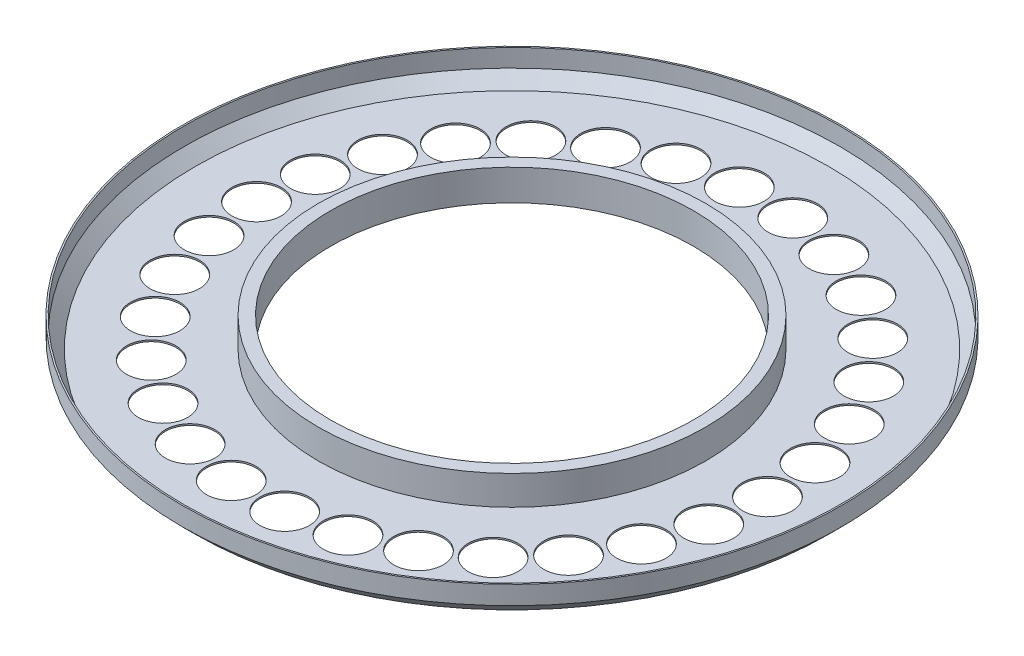
from build123d import *
from build123d.topology import SkipClean

# Parameters (mm, degrees)
SKETCH1_W           = 5
SKETCH1_H           = 53.385
CHAMFER1_SIZE       = 2
SHELL1_T            = -0.25
CUT_EXTRUDE1_DEPTH  = 10
BOSS_EXTRUDE1_DEPTH = 5
CUT_EXTRUDE2_DEPTH  = 76.663177636
CIRPATTERN1_COUNT   = 30


with BuildPart() as part:
    # Sketch1 → Revolve1 (revolve)
    with BuildSketch(Plane.YZ, mode=Mode.PRIVATE) as revolve1_sk:
        with Locations((2.5, 26.6925)):
            Rectangle(SKETCH1_W, SKETCH1_H)
    revolve(revolve1_sk.sketch.rotate(Axis((0, -14.724137931, 0), (0, 1, 0)), 180), axis=Axis((0, -14.724137931, 0), (0, 1, 0)))

    # Chamfer1
    chamfer1_edges = [part.edges().sort_by_distance(p)[0] for p in [
        (0, 0, 53.385),
    ]]
    chamfer(chamfer1_edges, length=CHAMFER1_SIZE)

    # Shell1
    shell1_openings = [part.faces().sort_by_distance(p)[0] for p in [
        (0, 5, 0),
    ]]
    offset(amount=SHELL1_T, openings=shell1_openings, kind=Kind.INTERSECTION)

    # Sketch2 → Cut-Extrude1 (cut)
    with BuildSketch(Plane.XZ):
        with BuildLine():
            ThreePointArc((-29.385, 0), (0, -29.385), (29.385, 0))
            Line((29.385, 0), (-29.385, 0))
        make_face()
        with BuildLine():
            Line((-29.385, 0), (29.385, 0))
            ThreePointArc((29.385, 0), (0, 29.385), (-29.385, 0))
        make_face()
    extrude(amount=-CUT_EXTRUDE1_DEPTH, mode=Mode.SUBTRACT)

    # Sketch2<3> → Boss-Extrude1 (add)
    with BuildSketch(Plane.XZ):
        with BuildLine():
            ThreePointArc((-29.385, 0), (0, 29.385), (29.385, 0))
            Line((29.385, 0), (31.385, 0))
            ThreePointArc((31.385, 0), (0, 31.385), (-31.385, 0))
            Line((-31.385, 0), (-29.385, 0))
        make_face()
        with BuildLine():
            Line((31.385, 0), (29.385, 0))
            ThreePointArc((29.385, 0), (0, -29.385), (-29.385, 0))
            Line((-29.385, 0), (-31.385, 0))
            ThreePointArc((-31.385, 0), (0, -31.385), (31.385, 0))
        make_face()
    extrude(amount=-BOSS_EXTRUDE1_DEPTH)

    # Sketch2<4> → Cut-Extrude2 (cut, symmetric)
    with SkipClean():  # the faces are left unmerged after this step: merging them gives an invalid solid
        with BuildSketch(Plane.XZ):
            with BuildLine():
                ThreePointArc((-45.38, 0), (-41.38, -4), (-37.38, 0))
                Line((-37.38, 0), (-45.38, 0))
            make_face()
            with BuildLine():
                Line((-45.38, 0), (-37.38, 0))
                ThreePointArc((-37.38, 0), (-41.38, 4), (-45.38, 0))
            make_face()
        cut_extrude2 = extrude(amount=CUT_EXTRUDE2_DEPTH, both=True, mode=Mode.SUBTRACT)

    # CirPattern1: Cut-Extrude2 ×30 about axis
    with SkipClean():  # the faces are left unmerged after this step: merging them gives an invalid solid
        cirpattern1_axis = Axis((0, 0, 0), (0, 1, 0))
        for i in range(1, CIRPATTERN1_COUNT):
            add(cut_extrude2.rotate(cirpattern1_axis, i * 360 / CIRPATTERN1_COUNT), mode=Mode.SUBTRACT)


solid = part.part
